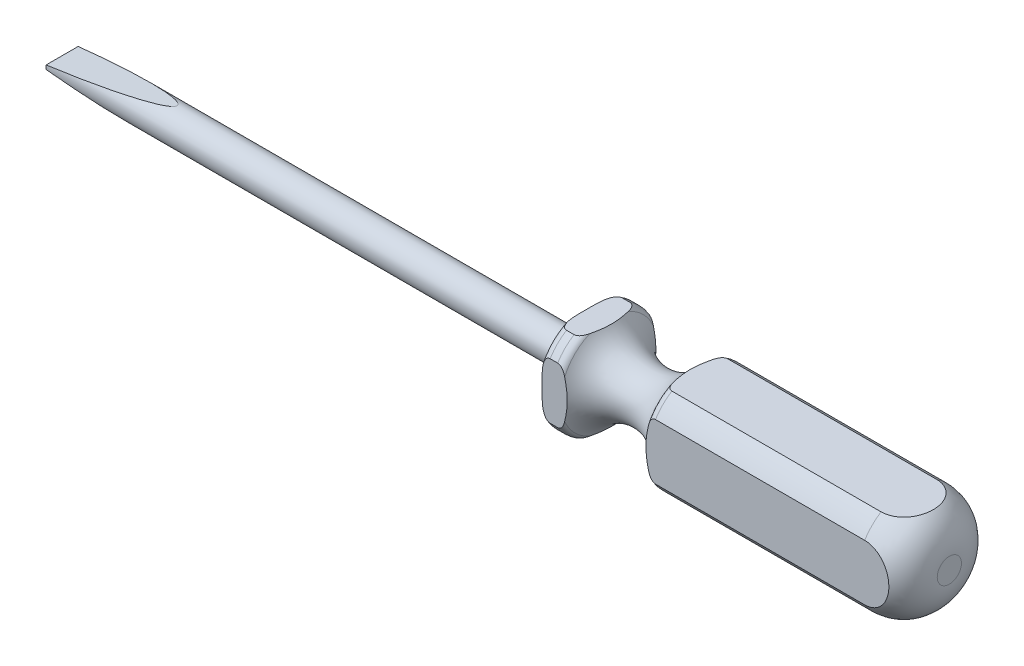
from build123d import *

# Parameters (mm, degrees)
CUT_EXTRUDE3_DEPTH      = 141.1869469
CUT_EXTRUDE3_DEPTH_BACK = 141.1869469
SKETCH8_OUTSIDE_W       = 46.838
SKETCH8_OUTSIDE_H       = 46.838
SKETCH8_OUTSIDE_W_2     = 13.97
SKETCH8_OUTSIDE_H_2     = 13.97
CUT_EXTRUDE4_DEPTH      = 141.186946801


with BuildPart() as part:
    # Sketch1 → Revolve3 (revolve)
    with BuildSketch(Plane.XY, mode=Mode.PRIVATE) as revolve3_sk:
        with BuildLine():
            Line((0, 0), (0, 2.54))
            Line((0, 2.54), (82.55, 2.54))
            Line((82.55, 2.54), (82.55, 6.985))
            ThreePointArc((82.55, 6.985), (82.921974388, 7.883025612), (83.82, 8.255))
            Line((83.82, 8.255), (85.01103416, 8.255))
            ThreePointArc((85.01103416, 8.255), (85.64603416, 8.084852263), (86.110886423, 7.62))
            ThreePointArc((86.110886423, 7.62), (92.71, 3.81), (99.309113577, 7.62))
            ThreePointArc((99.309113577, 7.62), (99.77396584, 8.084852263), (100.40896584, 8.255))
            Line((100.40896584, 8.255), (133.35, 8.255))
            ThreePointArc((133.35, 8.255), (137.840128061, 6.395128061), (139.7, 1.905))
            Line((139.7, 1.905), (139.7, 0))
            Line((139.7, 0), (0, 0))
        make_face()
    revolve(revolve3_sk.sketch.rotate(Axis((-862.051792103, 0, 0), (1, 0, 0)), 90), axis=Axis((-862.051792103, 0, 0), (1, 0, 0)))

    # Sketch5 → Cut-Extrude3 (cut, two sides: drawn at the far end of the back side and taken through both)
    with BuildSketch(Plane.XY.offset(-CUT_EXTRUDE3_DEPTH_BACK)):
        Polygon((270.361206931, -33.513682078), (18.100809936, -2.54), (0, -0.3175), (0, 0.3175), (18.100809936, 2.54), (270.361206931, 33.513682078), (-237.948450162, 33.513682078), (-237.948450162, -33.513682078), align=None)
    extrude(amount=CUT_EXTRUDE3_DEPTH + CUT_EXTRUDE3_DEPTH_BACK, mode=Mode.SUBTRACT)

    # Sketch8 outside → Cut-Extrude4 (cut, through all)
    with BuildSketch(Plane(origin=(139.7, 0, 0), x_dir=(0, 0, -1), z_dir=(1, 0, 0))):
        Rectangle(SKETCH8_OUTSIDE_W, SKETCH8_OUTSIDE_H)
        Rectangle(SKETCH8_OUTSIDE_W_2, SKETCH8_OUTSIDE_H_2, mode=Mode.SUBTRACT)
    extrude(amount=-CUT_EXTRUDE4_DEPTH, mode=Mode.SUBTRACT)


solid = part.part
